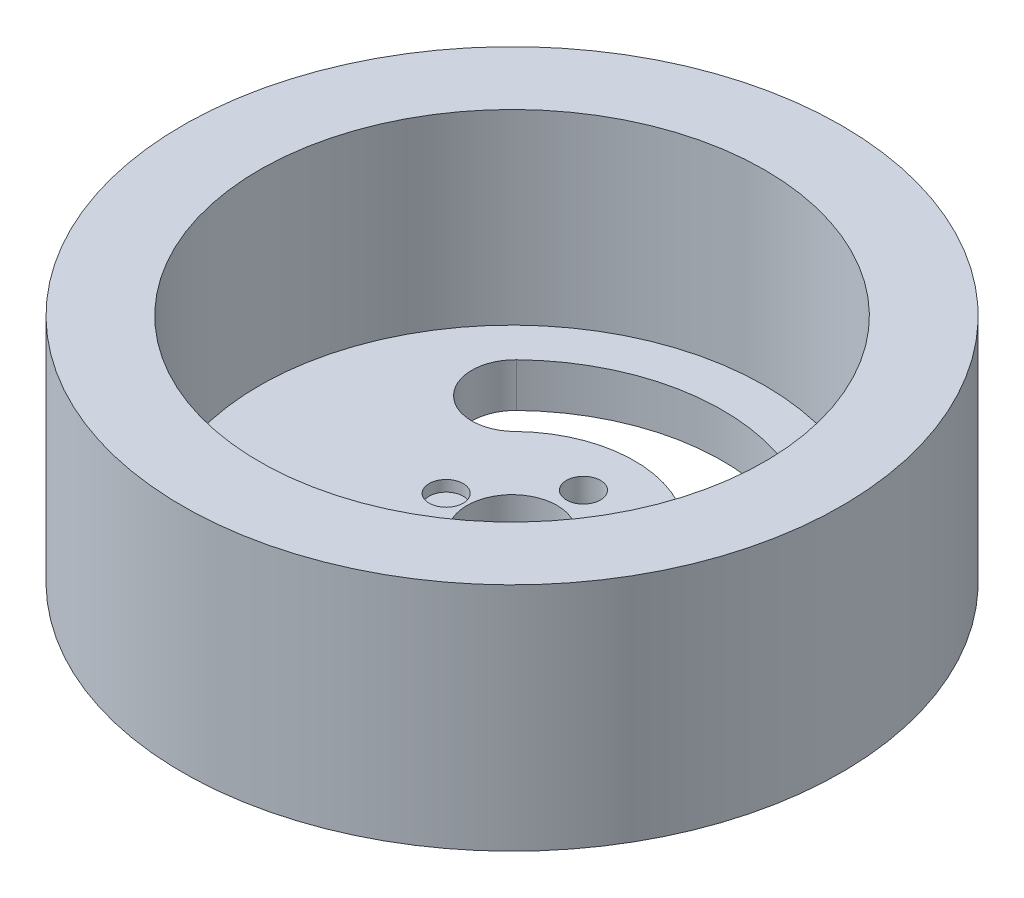
from build123d import *

# Parameters (mm, degrees)
SKETCH_1_R          = 30
SKETCH_1_R_2        = 23
EXTRUDE_1_DEPTH     = 21
SKETCH_2_R          = 23
SKETCH_2_R_2        = 4.1
SKETCH_2_R_3        = 1.55
EXTRUDE_2_DEPTH     = 1
EXTRUDE_START       = 3
SKETCH_3_R          = 30
SKETCH_3_R_2        = 1.55
SKETCH_3_R_3        = 4.1
EXTRUDE_3_DEPTH     = 3
CUT_EXTRUDE_START   = -3
SKETCH_4_R          = 30
CUT_EXTRUDE_1_DEPTH = 3


with BuildPart() as part:
    # 草图1 → 凸台-拉伸1 (new body)
    with BuildSketch(Plane(origin=(0, 0, 0), x_dir=(1, 0, 0), z_dir=(0, 1, 0))):
        with Locations(Location((0, 0, 0), (0, 0, 90))):
            Circle(SKETCH_1_R)
        with Locations(Location((0, 0, 0), (0, 0, 90))):
            Circle(SKETCH_1_R_2, mode=Mode.SUBTRACT)
    extrude(amount=EXTRUDE_1_DEPTH)

    # 草图2 → 凸台-拉伸2 (add)
    with BuildSketch(Plane.XZ):
        with Locations(Location((0, 0, 0), (0, 0, 270))):
            Circle(SKETCH_2_R)
        with Locations(Location((0, 0, 0), (0, 0, 270))):
            Circle(SKETCH_2_R_2, mode=Mode.SUBTRACT)
        with Locations(Location((6, 0, 0), (0, 0, 270))):
            Circle(SKETCH_2_R_3, mode=Mode.SUBTRACT)
        with Locations(Location((-6, 0, 0), (0, 0, 270))):
            Circle(SKETCH_2_R_3, mode=Mode.SUBTRACT)
        with Locations(Location((0, 6.5, 0), (0, 0, 270))):
            Circle(SKETCH_2_R_3, mode=Mode.SUBTRACT)
        with Locations(Location((0, -6.5, 0), (0, 0, 270))):
            Circle(SKETCH_2_R_3, mode=Mode.SUBTRACT)
        with BuildLine():
            ThreePointArc((13.744660155, 13.324975875), (0.2967616, 19.141123201), (-13.324975875, 13.744660155))
            ThreePointArc((-13.324975875, 13.744660155), (-13.412668503, 8.088485652), (-7.756494001, 8.000793024))
            ThreePointArc((-7.756494001, 8.000793024), (0.172745496, 11.142084508), (8.000793024, 7.756494001))
            ThreePointArc((8.000793024, 7.756494001), (13.656967527, 7.668801373), (13.744660155, 13.324975875))
        make_face(mode=Mode.SUBTRACT)
        with BuildLine():
            ThreePointArc((13.744660155, -13.324975875), (0.2967616, -19.141123201), (-13.324975875, -13.744660155))
            ThreePointArc((-13.324975875, -13.744660155), (-13.412668503, -8.088485652), (-7.756494001, -8.000793024))
            ThreePointArc((-7.756494001, -8.000793024), (0.172745496, -11.142084508), (8.000793024, -7.756494001))
            ThreePointArc((8.000793024, -7.756494001), (13.656967527, -7.668801373), (13.744660155, -13.324975875))
        make_face(mode=Mode.SUBTRACT)
    extrude(amount=-EXTRUDE_2_DEPTH)

    # 草图3 → 凸台-拉伸3 (add)
    with BuildSketch(Plane.XZ.offset(EXTRUDE_START)):
        with Locations(Location((0, 0, 0), (0, 0, 270))):
            Circle(SKETCH_3_R)
        with Locations(Location((0, -6.5, 0), (0, 0, 270))):
            Circle(SKETCH_3_R_2, mode=Mode.SUBTRACT)
        with Locations(Location((6, 0, 0), (0, 0, 270))):
            Circle(SKETCH_3_R_2, mode=Mode.SUBTRACT)
        with Locations(Location((0, 0, 0), (0, 0, 270))):
            Circle(SKETCH_3_R_3, mode=Mode.SUBTRACT)
        with Locations(Location((0, 6.5, 0), (0, 0, 270))):
            Circle(SKETCH_3_R_2, mode=Mode.SUBTRACT)
        with BuildLine():
            ThreePointArc((-7.756494001, -8.000793024), (-13.412668503, -8.088485652), (-13.324975875, -13.744660155))
            ThreePointArc((-13.324975875, -13.744660155), (0.2967616, -19.141123201), (13.744660155, -13.324975875))
            ThreePointArc((13.744660155, -13.324975875), (13.656967527, -7.668801373), (8.000793024, -7.756494001))
            ThreePointArc((8.000793024, -7.756494001), (0.172745496, -11.142084508), (-7.756494001, -8.000793024))
        make_face(mode=Mode.SUBTRACT)
        with BuildLine():
            ThreePointArc((8.000793024, 7.756494001), (13.656967527, 7.668801373), (13.744660155, 13.324975875))
            ThreePointArc((13.744660155, 13.324975875), (0.2967616, 19.141123201), (-13.324975875, 13.744660155))
            ThreePointArc((-13.324975875, 13.744660155), (-13.412668503, 8.088485652), (-7.756494001, 8.000793024))
            ThreePointArc((-7.756494001, 8.000793024), (0.172745496, 11.142084508), (8.000793024, 7.756494001))
        make_face(mode=Mode.SUBTRACT)
    extrude(amount=-EXTRUDE_3_DEPTH)

    # 草图4 → 切除-拉伸1 (cut)
    with BuildSketch(Plane(origin=(0, 21, 0), x_dir=(1, 0, 0), z_dir=(0, 1, 0)).offset(CUT_EXTRUDE_START)):
        with Locations(Location((0, 0, 0), (0, 0, 90))):
            Circle(SKETCH_4_R)
    extrude(amount=CUT_EXTRUDE_1_DEPTH, mode=Mode.SUBTRACT)


solid = part.part
